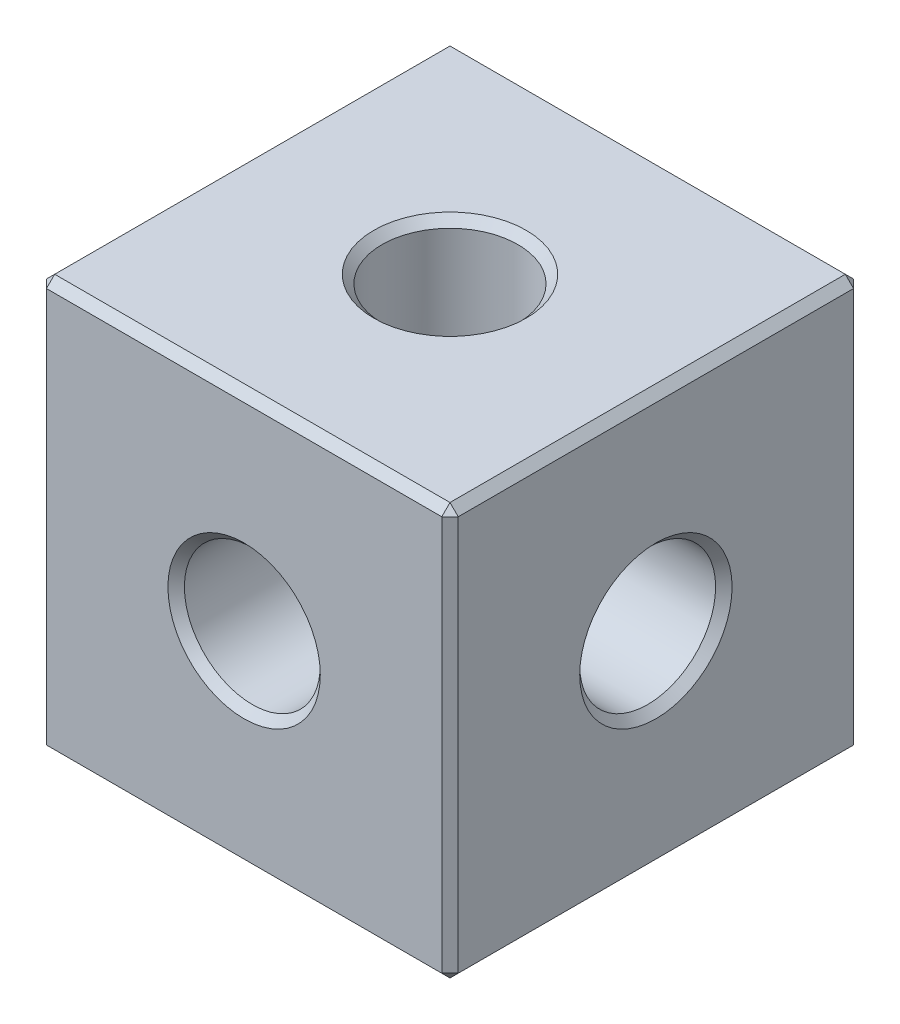
from build123d import *

# Parameters (mm, degrees)
SKETCH_1_W         = 10
SKETCH_1_H         = 10
EXTRUDE_1_DEPTH    = 5
HOLE_WIZARD_M4_1_D = 3.3
HOLE_WIZARD_M4_2_D = 3.3
HOLE_WIZARD_M4_3_D = 3.3
CHAMFER_1_SIZE     = 0.2


with BuildPart() as part:
    # 草图1 → 凸台-拉伸1 (new, symmetric)
    with BuildSketch(Plane(origin=(0, 0, 0), x_dir=(1, 0, 0), z_dir=(0, 1, 0))):
        Rectangle(SKETCH_1_W, SKETCH_1_H)
    extrude(amount=EXTRUDE_1_DEPTH, both=True)

    # M4 螺纹孔1 (through all)
    with Locations(Plane.XY.offset(5)):
        with Locations((0, 0)):
            Hole(HOLE_WIZARD_M4_1_D / 2)

    # M4 螺纹孔2 (through all)
    with Locations(Plane(origin=(0, 5, 0), x_dir=(1, 0, 0), z_dir=(0, 1, 0))):
        with Locations((0, 0)):
            Hole(HOLE_WIZARD_M4_2_D / 2)

    # M4 螺纹孔3 (through all)
    with Locations(Plane(origin=(5, 0, 0), x_dir=(0, 0, -1), z_dir=(1, 0, 0))):
        with Locations((0, 0)):
            Hole(HOLE_WIZARD_M4_3_D / 2)

    # 倒角1
    chamfer_1_edges = [part.edges().sort_by_distance(p)[0] for p in [
        (-5, 5, 0),
        (1.65, 0, 5),
        (1.65, 0, -5),
        (0, 5, 5),
        (1.65, -5, 0),
        (1.65, 5, 0),
        (-5, 0, -1.65),
        (5, 0, -1.65),
        (5, 5, 0),
        (0, -5, 5),
        (-5, -5, 0),
        (0, -5, -5),
        (5, -5, 0),
        (5, 0, 5),
        (-5, 0, 5),
        (-5, 0, -5),
        (5, 0, -5),
        (0, 5, -5),
    ]]
    chamfer(chamfer_1_edges, length=CHAMFER_1_SIZE)


solid = part.part
